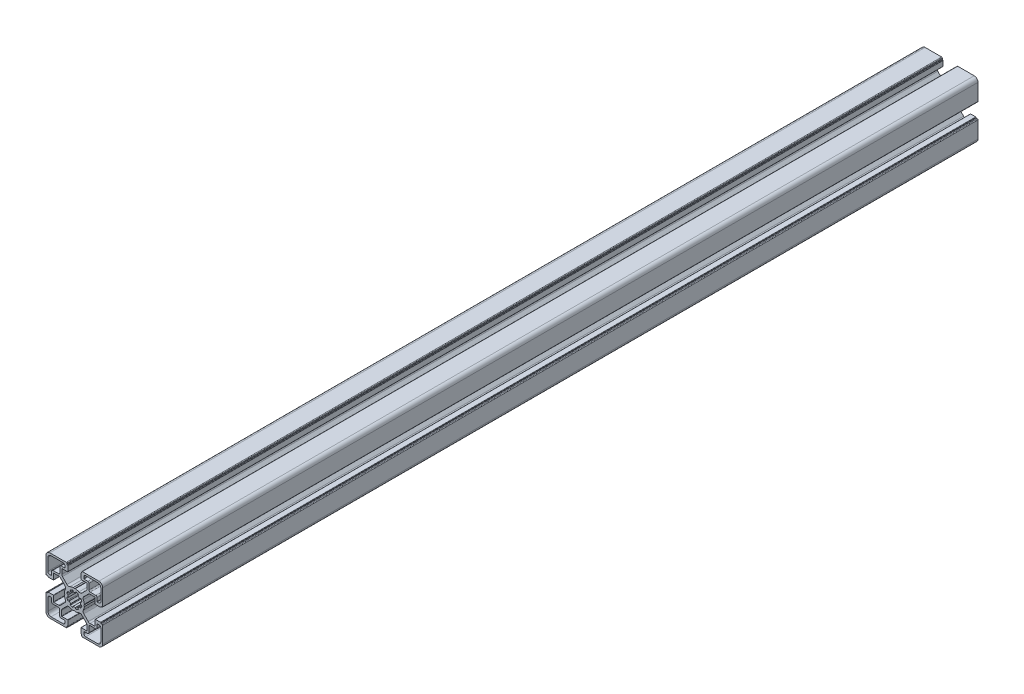
from build123d import *

# Parameters (mm, degrees)
EXTRUDE_1_DEPTH = 695


with BuildPart() as part:
    # Model → Бобышка-Вытянуть1 (new body)
    with BuildSketch(Plane.XY):
        with BuildLine():
            Line((-7.526864431, -5.845554514), (-11.106303421, -9.424989489))
            ThreePointArc((-11.106303421, -9.424989489), (-11.737148242, -9.846506139), (-12.481280258, -9.994523091))
            Line((-12.481280258, -9.994523091), (-16.276538209, -9.994523091))
            ThreePointArc((-16.276538209, -9.994523091), (-16.417959587, -9.935944438), (-16.47653824, -9.79452306))
            Line((-16.47653824, -9.79452306), (-16.47653824, -5.350000832))
            ThreePointArc((-16.47653824, -5.350000832), (-16.535116893, -5.208579453), (-16.676538271, -5.150000801))
            Line((-16.676538271, -5.150000801), (-20.676504155, -5.150000801))
            ThreePointArc((-20.676504155, -5.150000801), (-20.888636223, -5.23786878), (-20.976504202, -5.450000847))
            Line((-20.976504202, -5.450000847), (-20.976504202, -5.575745712))
            ThreePointArc((-20.976504202, -5.575745712), (-21.064371969, -5.787877267), (-21.276503524, -5.875745034))
            Line((-21.276503524, -5.875745034), (-21.976504359, -5.875745034))
            ThreePointArc((-21.976504359, -5.875745034), (-22.330057804, -6.022191666), (-22.476504437, -6.375745112))
            Line((-22.476504437, -6.375745112), (-22.476504437, -19.500019143))
            ThreePointArc((-22.476504437, -19.500019143), (-21.5978253, -21.621338231), (-19.476506212, -22.500017368))
            Line((-19.476506212, -22.500017368), (-6.352231806, -22.500017368))
            ThreePointArc((-6.352231806, -22.500017368), (-5.998678625, -22.353570845), (-5.852232102, -22.000017663))
            Line((-5.852232102, -22.000017663), (-5.852232102, -21.300016457))
            ThreePointArc((-5.852232102, -21.300016457), (-5.764364335, -21.087884901), (-5.55223278, -21.000017134))
            Line((-5.55223278, -21.000017134), (-5.426521426, -21.000017134))
            ThreePointArc((-5.426521426, -21.000017134), (-5.214390224, -20.912149513), (-5.126522603, -20.700018312))
            Line((-5.126522603, -20.700018312), (-5.126522603, -16.700016467))
            ThreePointArc((-5.126522603, -16.700016467), (-5.185101256, -16.558595089), (-5.326522635, -16.500016436))
            Line((-5.326522635, -16.500016436), (-9.88190891, -16.500016436))
            ThreePointArc((-9.88190891, -16.500016436), (-10.023330289, -16.441437783), (-10.081908942, -16.300016405))
            Line((-10.081908942, -16.300016405), (-10.081908942, -12.471584891))
            ThreePointArc((-10.081908942, -12.471584891), (-9.929667937, -11.706217678), (-9.496122237, -11.057370685))
            Line((-9.496122237, -11.057370685), (-5.933266365, -7.494514812))
            ThreePointArc((-5.933266365, -7.494514812), (-4.831630544, -6.933305536), (-3.610546427, -7.126982875))
            ThreePointArc((-3.610546427, -7.126982875), (-2.230901141, -7.675792707), (-0.773599085, -7.960193947))
            Line((-0.773599085, -7.960193947), (0.023478196, -7.500001164))
            Line((0.023478196, -7.500001164), (0.820555477, -7.960193947))
            ThreePointArc((0.820555477, -7.960193947), (2.230063239, -7.689668544), (3.568550147, -7.171644493))
            ThreePointArc((3.568550147, -7.171644493), (4.779679596, -6.991115403), (5.86903271, -7.550342627))
            Line((5.86903271, -7.550342627), (9.448467685, -11.129781616))
            ThreePointArc((9.448467685, -11.129781616), (9.869984335, -11.760626438), (10.018001287, -12.504758454))
            Line((10.018001287, -12.504758454), (10.018001287, -16.300016405))
            ThreePointArc((10.018001287, -16.300016405), (9.959422634, -16.441437783), (9.818001256, -16.500016436))
            Line((9.818001256, -16.500016436), (5.373479028, -16.500016436))
            ThreePointArc((5.373479028, -16.500016436), (5.232057649, -16.558595089), (5.173478997, -16.700016467))
            Line((5.173478997, -16.700016467), (5.173478997, -20.699982351))
            ThreePointArc((5.173478997, -20.699982351), (5.261346976, -20.912114419), (5.473479043, -20.999982398))
            Line((5.473479043, -20.999982398), (5.599223908, -20.999982398))
            ThreePointArc((5.599223908, -20.999982398), (5.811355463, -21.087850165), (5.89922323, -21.29998172))
            Line((5.89922323, -21.29998172), (5.89922323, -21.999982555))
            ThreePointArc((5.89922323, -21.999982555), (6.045669862, -22.353536), (6.399223308, -22.499982632))
            Line((6.399223308, -22.499982632), (19.523497339, -22.499982632))
            ThreePointArc((19.523497339, -22.499982632), (21.644816427, -21.621303496), (22.523495563, -19.499984408))
            Line((22.523495563, -19.499984408), (22.523495563, -6.375710002))
            ThreePointArc((22.523495563, -6.375710002), (22.377049041, -6.022156821), (22.023495859, -5.875710298))
            Line((22.023495859, -5.875710298), (21.323494652, -5.875710298))
            ThreePointArc((21.323494652, -5.875710298), (21.111363097, -5.787842531), (21.02349533, -5.575710976))
            Line((21.02349533, -5.575710976), (21.02349533, -5.449999622))
            ThreePointArc((21.02349533, -5.449999622), (20.935627709, -5.23786842), (20.723496508, -5.150000799))
            Line((20.723496508, -5.150000799), (16.723494663, -5.150000799))
            ThreePointArc((16.723494663, -5.150000799), (16.582073285, -5.208579452), (16.523494632, -5.35000083))
            Line((16.523494632, -5.35000083), (16.523494632, -9.905387106))
            ThreePointArc((16.523494632, -9.905387106), (16.464915979, -10.046808485), (16.323494601, -10.105387137))
            Line((16.323494601, -10.105387137), (12.495063087, -10.105387137))
            ThreePointArc((12.495063087, -10.105387137), (11.729695874, -9.953146133), (11.080848881, -9.519600433))
            Line((11.080848881, -9.519600433), (7.517993008, -5.956744561))
            ThreePointArc((7.517993008, -5.956744561), (6.956783732, -4.85510874), (7.150461071, -3.634024623))
            ThreePointArc((7.150461071, -3.634024623), (7.699270902, -2.254379337), (7.983672143, -0.797077281))
            Line((7.983672143, -0.797077281), (7.52347936, 0))
            Line((7.52347936, 0), (7.983672143, 0.797077281))
            ThreePointArc((7.983672143, 0.797077281), (7.71314674, 2.206585043), (7.195122689, 3.545071951))
            ThreePointArc((7.195122689, 3.545071951), (7.014593599, 4.7562014), (7.573820823, 5.845554514))
            Line((7.573820823, 5.845554514), (11.153259812, 9.424989489))
            ThreePointArc((11.153259812, 9.424989489), (11.784104634, 9.846506139), (12.52823665, 9.994523091))
            Line((12.52823665, 9.994523091), (16.323494601, 9.994523091))
            ThreePointArc((16.323494601, 9.994523091), (16.464915979, 9.935944438), (16.523494632, 9.79452306))
            Line((16.523494632, 9.79452306), (16.523494632, 5.350000832))
            ThreePointArc((16.523494632, 5.350000832), (16.582073285, 5.208579453), (16.723494663, 5.150000801))
            Line((16.723494663, 5.150000801), (20.723460547, 5.150000801))
            ThreePointArc((20.723460547, 5.150000801), (20.935592615, 5.23786878), (21.023460594, 5.450000847))
            Line((21.023460594, 5.450000847), (21.023460594, 5.575745712))
            ThreePointArc((21.023460594, 5.575745712), (21.111328361, 5.787877267), (21.323459916, 5.875745034))
            Line((21.323459916, 5.875745034), (22.023460751, 5.875745034))
            ThreePointArc((22.023460751, 5.875745034), (22.377014196, 6.022191666), (22.523460828, 6.375745112))
            Line((22.523460828, 6.375745112), (22.523460828, 19.500019143))
            ThreePointArc((22.523460828, 19.500019143), (21.644781692, 21.621338231), (19.523462604, 22.500017368))
            Line((19.523462604, 22.500017368), (6.399188198, 22.500017368))
            ThreePointArc((6.399188198, 22.500017368), (6.045635017, 22.353570845), (5.899188494, 22.000017663))
            Line((5.899188494, 22.000017663), (5.899188494, 21.300016457))
            ThreePointArc((5.899188494, 21.300016457), (5.811320727, 21.087884901), (5.599189171, 21.000017134))
            Line((5.599189171, 21.000017134), (5.473477818, 21.000017134))
            ThreePointArc((5.473477818, 21.000017134), (5.261346616, 20.912149513), (5.173478995, 20.700018312))
            Line((5.173478995, 20.700018312), (5.173478995, 16.700016467))
            ThreePointArc((5.173478995, 16.700016467), (5.232057648, 16.558595089), (5.373479026, 16.500016436))
            Line((5.373479026, 16.500016436), (9.928865302, 16.500016436))
            ThreePointArc((9.928865302, 16.500016436), (10.070286681, 16.441437783), (10.128865333, 16.300016405))
            Line((10.128865333, 16.300016405), (10.128865333, 12.471584891))
            ThreePointArc((10.128865333, 12.471584891), (9.976624329, 11.706217678), (9.543078629, 11.057370685))
            Line((9.543078629, 11.057370685), (5.980222757, 7.494514812))
            ThreePointArc((5.980222757, 7.494514812), (4.878586936, 6.933305536), (3.657502819, 7.126982875))
            ThreePointArc((3.657502819, 7.126982875), (2.277857533, 7.675792707), (0.820555477, 7.960193947))
            Line((0.820555477, 7.960193947), (0.023478196, 7.500001164))
            Line((0.023478196, 7.500001164), (-0.773599085, 7.960193947))
            ThreePointArc((-0.773599085, 7.960193947), (-2.183106847, 7.689668544), (-3.521593755, 7.171644493))
            ThreePointArc((-3.521593755, 7.171644493), (-4.732723204, 6.991115403), (-5.822076318, 7.550342627))
            Line((-5.822076318, 7.550342627), (-9.401511293, 11.129781616))
            ThreePointArc((-9.401511293, 11.129781616), (-9.823027943, 11.760626438), (-9.971044895, 12.504758454))
            Line((-9.971044895, 12.504758454), (-9.971044895, 16.300016405))
            ThreePointArc((-9.971044895, 16.300016405), (-9.912466242, 16.441437783), (-9.771044864, 16.500016436))
            Line((-9.771044864, 16.500016436), (-5.326522636, 16.500016436))
            ThreePointArc((-5.326522636, 16.500016436), (-5.185101258, 16.558595089), (-5.126522605, 16.700016467))
            Line((-5.126522605, 16.700016467), (-5.126522605, 20.699982351))
            ThreePointArc((-5.126522605, 20.699982351), (-5.214390584, 20.912114419), (-5.426522651, 20.999982398))
            Line((-5.426522651, 20.999982398), (-5.552267516, 20.999982398))
            ThreePointArc((-5.552267516, 20.999982398), (-5.764399071, 21.087850165), (-5.852266838, 21.29998172))
            Line((-5.852266838, 21.29998172), (-5.852266838, 21.999982555))
            ThreePointArc((-5.852266838, 21.999982555), (-5.99871347, 22.353536), (-6.352266916, 22.499982632))
            Line((-6.352266916, 22.499982632), (-19.476540947, 22.499982632))
            ThreePointArc((-19.476540947, 22.499982632), (-21.597860035, 21.621303496), (-22.476539172, 19.499984408))
            Line((-22.476539172, 19.499984408), (-22.476539172, 6.375710002))
            ThreePointArc((-22.476539172, 6.375710002), (-22.330092649, 6.022156821), (-21.976539468, 5.875710298))
            Line((-21.976539468, 5.875710298), (-21.276538261, 5.875710298))
            ThreePointArc((-21.276538261, 5.875710298), (-21.064406705, 5.787842531), (-20.976538938, 5.575710976))
            Line((-20.976538938, 5.575710976), (-20.976538938, 5.449999622))
            ThreePointArc((-20.976538938, 5.449999622), (-20.888671317, 5.23786842), (-20.676540116, 5.150000799))
            Line((-20.676540116, 5.150000799), (-16.676538271, 5.150000799))
            ThreePointArc((-16.676538271, 5.150000799), (-16.535116893, 5.208579452), (-16.47653824, 5.35000083))
            Line((-16.47653824, 5.35000083), (-16.47653824, 9.905387106))
            ThreePointArc((-16.47653824, 9.905387106), (-16.417959587, 10.046808485), (-16.276538209, 10.105387137))
            Line((-16.276538209, 10.105387137), (-12.448106696, 10.105387137))
            ThreePointArc((-12.448106696, 10.105387137), (-11.682739482, 9.953146133), (-11.033892489, 9.519600433))
            Line((-11.033892489, 9.519600433), (-7.471036617, 5.956744561))
            ThreePointArc((-7.471036617, 5.956744561), (-6.90982734, 4.85510874), (-7.10350468, 3.634024623))
            ThreePointArc((-7.10350468, 3.634024623), (-7.652314511, 2.254379337), (-7.936715751, 0.797077281))
            Line((-7.936715751, 0.797077281), (-7.476522968, 0))
            Line((-7.476522968, 0), (-7.936715751, -0.797077281))
            ThreePointArc((-7.936715751, -0.797077281), (-7.666190348, -2.206585043), (-7.148166297, -3.545071951))
            ThreePointArc((-7.148166297, -3.545071951), (-6.967637207, -4.7562014), (-7.526864431, -5.845554514))
        make_face()
        with BuildLine():
            Line((-18.176538504, 7.499980302), (-19.476538705, 7.499980302))
            ThreePointArc((-19.476538705, 7.499980302), (-20.537199042, 7.939320199), (-20.976538938, 8.999980535))
            Line((-20.976538938, 8.999980535), (-20.976538938, 18.499983878))
            ThreePointArc((-20.976538938, 18.499983878), (-20.244306324, 20.267749784), (-18.476540418, 20.999982398))
            Line((-18.476540418, 20.999982398), (-8.976728075, 20.999982398))
            ThreePointArc((-8.976728075, 20.999982398), (-7.916067739, 20.560642501), (-7.476727843, 19.499982165))
            Line((-7.476727843, 19.499982165), (-7.476727843, 18.199981963))
            ThreePointArc((-7.476727843, 18.199981963), (-7.535306496, 18.058560585), (-7.676727874, 17.999981932))
            Line((-7.676727874, 17.999981932), (-10.471044973, 17.999981932))
            ThreePointArc((-10.471044973, 17.999981932), (-11.178151864, 17.707088668), (-11.471045128, 16.999981777))
            Line((-11.471045128, 16.999981777), (-11.471045128, 12.605387526))
            ThreePointArc((-11.471045128, 12.605387526), (-11.763938392, 11.898280635), (-12.471045283, 11.60538737))
            Line((-12.471045283, 11.60538737), (-16.976538317, 11.60538737))
            ThreePointArc((-16.976538317, 11.60538737), (-17.683645208, 11.312494106), (-17.976538472, 10.605387215))
            Line((-17.976538472, 10.605387215), (-17.976538472, 7.699980333))
            ThreePointArc((-17.976538472, 7.699980333), (-18.035117125, 7.558558955), (-18.176538504, 7.499980302))
        make_face(mode=Mode.SUBTRACT)
        with BuildLine():
            Line((3.214790598, 4.562598924), (2.887479062, 4.098476156))
            ThreePointArc((2.887479062, 4.098476156), (3.553611694, 3.540927173), (4.113191721, 2.876499791))
            Line((4.113191721, 2.876499791), (4.590256556, 3.208163001))
            ThreePointArc((4.590256556, 3.208163001), (4.992439812, 3.298771194), (5.325976908, 3.056461017))
            ThreePointArc((5.325976908, 3.056461017), (5.674739058, 2.353311246), (5.930326778, 1.611199694))
            ThreePointArc((5.930326778, 1.611199694), (5.863231166, 1.20429321), (5.513209745, 0.986211313))
            Line((5.513209745, 0.986211313), (4.944024725, 0.887822963))
            ThreePointArc((4.944024725, 0.887822963), (5.023478972, 0), (4.944024725, -0.887822963))
            Line((4.944024725, -0.887822963), (5.513209745, -0.986211313))
            ThreePointArc((5.513209745, -0.986211313), (5.863231166, -1.20429321), (5.930326778, -1.611199694))
            ThreePointArc((5.930326778, -1.611199694), (5.674739058, -2.353311246), (5.325976908, -3.056461017))
            ThreePointArc((5.325976908, -3.056461017), (4.992439812, -3.298771194), (4.590256556, -3.208163001))
            Line((4.590256556, -3.208163001), (4.113191721, -2.876499791))
            ThreePointArc((4.113191721, -2.876499791), (3.553611694, -3.540927173), (2.887479062, -4.098476156))
            Line((2.887479062, -4.098476156), (3.214790598, -4.562598924))
            ThreePointArc((3.214790598, -4.562598924), (3.308094072, -4.964275845), (3.067863638, -5.299446288))
            ThreePointArc((3.067863638, -5.299446288), (2.362374532, -5.643478572), (1.61854986, -5.894073763))
            ThreePointArc((1.61854986, -5.894073763), (1.211334099, -5.829590068), (0.991000026, -5.481113786))
            Line((0.991000026, -5.481113786), (0.890867068, -4.924189711))
            ThreePointArc((0.890867068, -4.924189711), (0.023478196, -5.000000776), (-0.843910676, -4.924189711))
            Line((-0.843910676, -4.924189711), (-0.944043634, -5.481113786))
            ThreePointArc((-0.944043634, -5.481113786), (-1.164377707, -5.829590068), (-1.571593469, -5.894073763))
            ThreePointArc((-1.571593469, -5.894073763), (-2.31541814, -5.643478572), (-3.020907246, -5.299446288))
            ThreePointArc((-3.020907246, -5.299446288), (-3.261137681, -4.964275845), (-3.167834206, -4.562598924))
            Line((-3.167834206, -4.562598924), (-2.84052267, -4.098476156))
            ThreePointArc((-2.84052267, -4.098476156), (-3.506655302, -3.540927173), (-4.066235329, -2.876499791))
            Line((-4.066235329, -2.876499791), (-4.543300164, -3.208163001))
            ThreePointArc((-4.543300164, -3.208163001), (-4.94548342, -3.298771194), (-5.279020516, -3.056461017))
            ThreePointArc((-5.279020516, -3.056461017), (-5.627782666, -2.353311246), (-5.883370386, -1.611199694))
            ThreePointArc((-5.883370386, -1.611199694), (-5.816274774, -1.20429321), (-5.466253353, -0.986211313))
            Line((-5.466253353, -0.986211313), (-4.897068333, -0.887822963))
            ThreePointArc((-4.897068333, -0.887822963), (-4.97652258, 0), (-4.897068333, 0.887822963))
            Line((-4.897068333, 0.887822963), (-5.466253353, 0.986211313))
            ThreePointArc((-5.466253353, 0.986211313), (-5.816274774, 1.20429321), (-5.883370386, 1.611199694))
            ThreePointArc((-5.883370386, 1.611199694), (-5.627782666, 2.353311246), (-5.279020516, 3.056461017))
            ThreePointArc((-5.279020516, 3.056461017), (-4.94548342, 3.298771194), (-4.543300164, 3.208163001))
            Line((-4.543300164, 3.208163001), (-4.066235329, 2.876499791))
            ThreePointArc((-4.066235329, 2.876499791), (-3.506655302, 3.540927173), (-2.84052267, 4.098476156))
            Line((-2.84052267, 4.098476156), (-3.167834206, 4.562598924))
            ThreePointArc((-3.167834206, 4.562598924), (-3.261137681, 4.964275845), (-3.020907246, 5.299446288))
            ThreePointArc((-3.020907246, 5.299446288), (-2.31541814, 5.643478572), (-1.571593469, 5.894073763))
            ThreePointArc((-1.571593469, 5.894073763), (-1.164377707, 5.829590068), (-0.944043634, 5.481113786))
            Line((-0.944043634, 5.481113786), (-0.843910676, 4.924189711))
            ThreePointArc((-0.843910676, 4.924189711), (0.023478196, 5.000000776), (0.890867068, 4.924189711))
            Line((0.890867068, 4.924189711), (0.991000026, 5.481113786))
            ThreePointArc((0.991000026, 5.481113786), (1.211334099, 5.829590068), (1.61854986, 5.894073763))
            ThreePointArc((1.61854986, 5.894073763), (2.362374532, 5.643478572), (3.067863638, 5.299446288))
            ThreePointArc((3.067863638, 5.299446288), (3.308094072, 4.964275845), (3.214790598, 4.562598924))
        make_face(mode=Mode.SUBTRACT)
        with BuildLine():
            Line((18.223494895, -7.499980302), (19.523495097, -7.499980302))
            ThreePointArc((19.523495097, -7.499980302), (20.584155434, -7.939320199), (21.02349533, -8.999980535))
            Line((21.02349533, -8.999980535), (21.02349533, -18.499983878))
            ThreePointArc((21.02349533, -18.499983878), (20.291262716, -20.267749784), (18.52349681, -20.999982398))
            Line((18.52349681, -20.999982398), (9.023684467, -20.999982398))
            ThreePointArc((9.023684467, -20.999982398), (7.963024131, -20.560642501), (7.523684235, -19.499982165))
            Line((7.523684235, -19.499982165), (7.523684235, -18.199981963))
            ThreePointArc((7.523684235, -18.199981963), (7.582262887, -18.058560585), (7.723684266, -17.999981932))
            Line((7.723684266, -17.999981932), (10.518001365, -17.999981932))
            ThreePointArc((10.518001365, -17.999981932), (11.225108256, -17.707088668), (11.51800152, -16.999981777))
            Line((11.51800152, -16.999981777), (11.51800152, -12.605387526))
            ThreePointArc((11.51800152, -12.605387526), (11.810894784, -11.898280635), (12.518001675, -11.60538737))
            Line((12.518001675, -11.60538737), (17.023494709, -11.60538737))
            ThreePointArc((17.023494709, -11.60538737), (17.7306016, -11.312494106), (18.023494864, -10.605387215))
            Line((18.023494864, -10.605387215), (18.023494864, -7.699980333))
            ThreePointArc((18.023494864, -7.699980333), (18.082073517, -7.558558955), (18.223494895, -7.499980302))
        make_face(mode=Mode.SUBTRACT)
        with BuildLine():
            Line((7.523458498, 18.200016699), (7.523458498, 19.500016901))
            ThreePointArc((7.523458498, 19.500016901), (7.962798395, 20.560677238), (9.023458731, 21.000017134))
            Line((9.023458731, 21.000017134), (18.523462073, 21.000017134))
            ThreePointArc((18.523462073, 21.000017134), (20.29122798, 20.26778452), (21.023460594, 18.500018614))
            Line((21.023460594, 18.500018614), (21.023460594, 9.000206271))
            ThreePointArc((21.023460594, 9.000206271), (20.584120697, 7.939545935), (19.523460361, 7.500206039))
            Line((19.523460361, 7.500206039), (18.223460159, 7.500206039))
            ThreePointArc((18.223460159, 7.500206039), (18.082038781, 7.558784691), (18.023460128, 7.70020607))
            Line((18.023460128, 7.70020607), (18.023460128, 10.494523169))
            ThreePointArc((18.023460128, 10.494523169), (17.730566864, 11.20163006), (17.023459973, 11.494523324))
            Line((17.023459973, 11.494523324), (12.628865721, 11.494523324))
            ThreePointArc((12.628865721, 11.494523324), (11.92175883, 11.787416588), (11.628865566, 12.494523479))
            Line((11.628865566, 12.494523479), (11.628865566, 17.000016513))
            ThreePointArc((11.628865566, 17.000016513), (11.335972302, 17.707123404), (10.628865411, 18.000016668))
            Line((10.628865411, 18.000016668), (7.723458529, 18.000016668))
            ThreePointArc((7.723458529, 18.000016668), (7.582037151, 18.058595321), (7.523458498, 18.200016699))
        make_face(mode=Mode.SUBTRACT)
        with BuildLine():
            Line((-7.476502106, -18.200016699), (-7.476502106, -19.500016901))
            ThreePointArc((-7.476502106, -19.500016901), (-7.915842003, -20.560677238), (-8.976502339, -21.000017134))
            Line((-8.976502339, -21.000017134), (-18.476505682, -21.000017134))
            ThreePointArc((-18.476505682, -21.000017134), (-20.244271588, -20.26778452), (-20.976504202, -18.500018614))
            Line((-20.976504202, -18.500018614), (-20.976504202, -9.000206271))
            ThreePointArc((-20.976504202, -9.000206271), (-20.537164306, -7.939545935), (-19.476503969, -7.500206039))
            Line((-19.476503969, -7.500206039), (-18.176503767, -7.500206039))
            ThreePointArc((-18.176503767, -7.500206039), (-18.035082389, -7.558784691), (-17.976503736, -7.70020607))
            Line((-17.976503736, -7.70020607), (-17.976503736, -10.494523169))
            ThreePointArc((-17.976503736, -10.494523169), (-17.683610472, -11.20163006), (-16.976503581, -11.494523324))
            Line((-16.976503581, -11.494523324), (-12.58190933, -11.494523324))
            ThreePointArc((-12.58190933, -11.494523324), (-11.874802439, -11.787416588), (-11.581909174, -12.494523479))
            Line((-11.581909174, -12.494523479), (-11.581909174, -17.000016513))
            ThreePointArc((-11.581909174, -17.000016513), (-11.28901591, -17.707123404), (-10.581909019, -18.000016668))
            Line((-10.581909019, -18.000016668), (-7.676502137, -18.000016668))
            ThreePointArc((-7.676502137, -18.000016668), (-7.535080759, -18.058595321), (-7.476502106, -18.200016699))
        make_face(mode=Mode.SUBTRACT)
    extrude(amount=-EXTRUDE_1_DEPTH)


solid = part.part
